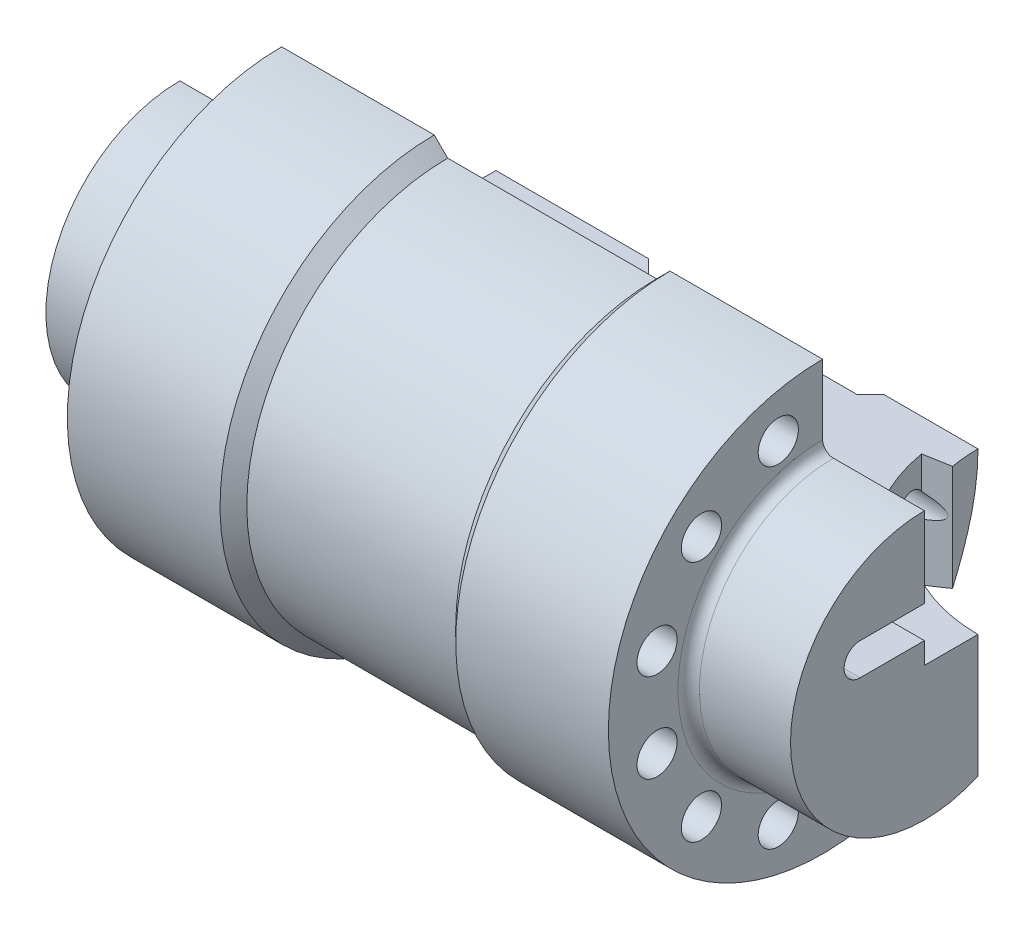
from build123d import *

# Parameters (mm, degrees)
REVOLVE1_ANGLE     = 270
CUT_EXTRUDE1_DEPTH = 151.069983674
SKETCH3_R          = 3.75
CUT_EXTRUDE2_DEPTH = 133.664991614
SKETCH5_R          = 30
CUT_EXTRUDE3_DEPTH = 151.069983674
CUT_EXTRUDE4_DEPTH = 151.06998382
CUT_EXTRUDE5_DEPTH = 10


with BuildPart() as part:
    # Sketch1 → Revolve1 (revolve)
    with BuildSketch(Plane.XY):
        with BuildLine():
            Line((47.5, 40), (50, 37.5))
            Line((50, 37.5), (89, 37.5))
            Line((89, 37.5), (91.5, 40))
            Line((91.5, 40), (120, 40))
            Line((120, 40), (120, 27))
            ThreePointArc((120, 27), (120.585786438, 25.585786438), (122, 25))
            Line((122, 25), (139, 25))
            Line((139, 25), (139, 0))
            Line((139, 0), (0, 0))
            Line((0, 0), (0, 25))
            Line((0, 25), (17, 25))
            ThreePointArc((17, 25), (18.414213562, 25.585786438), (19, 27))
            Line((19, 27), (19, 40))
            Line((19, 40), (47.5, 40))
        make_face()
    revolve(axis=Axis((0, 0, 0), (1, 0, 0)), revolution_arc=REVOLVE1_ANGLE)

    # Sketch2 → Cut-Extrude1 (cut, through all)
    with BuildSketch(Plane.ZY):
        with BuildLine():
            Line((0, 10), (12, 10))
            ThreePointArc((12, 10), (15, 7), (12, 4))
            Line((12, 4), (0, 4))
            ThreePointArc((0, 4), (-3, 7), (0, 10))
        make_face()
    extrude(amount=-CUT_EXTRUDE1_DEPTH, mode=Mode.SUBTRACT)

    # Sketch3 → Cut-Extrude2 (cut, through all)
    with BuildSketch(Plane(origin=(120, 0, 0), x_dir=(0, 0, -1), z_dir=(1, 0, 0))):
        with Locations((-8.282209443, 30.909626441)):
            Circle(SKETCH3_R)
        with Locations((30.909626441, -8.282209443)):
            Circle(SKETCH3_R)
        with Locations((22.627416998, -22.627416998)):
            Circle(SKETCH3_R)
        with Locations((8.282209443, -30.909626441)):
            Circle(SKETCH3_R)
        with Locations((-8.282209443, -30.909626441)):
            Circle(SKETCH3_R)
        with Locations((-22.627416998, -22.627416998)):
            Circle(SKETCH3_R)
        with Locations((-30.909626441, -8.282209443)):
            Circle(SKETCH3_R)
        with Locations((-30.909626441, 8.282209443)):
            Circle(SKETCH3_R)
        with Locations((-22.627416998, 22.627416998)):
            Circle(SKETCH3_R)
    extrude(amount=-CUT_EXTRUDE2_DEPTH, mode=Mode.SUBTRACT)

    # Sketch5 → Cut-Extrude3 (cut, through all)
    with BuildSketch(Plane(origin=(0, 0, 0), x_dir=(1, 0, 0), z_dir=(0, 1, 0))):
        with Locations((139, 40)):
            Circle(SKETCH5_R)
    extrude(amount=-CUT_EXTRUDE3_DEPTH, mode=Mode.SUBTRACT)

    # Sketch6 → Cut-Extrude4 (cut, through all)
    with BuildSketch(Plane(origin=(0, 0, 0), x_dir=(1, 0, 0), z_dir=(0, 1, 0))):
        with BuildLine():
            Line((104.531728645, 33.922313782), (109.45576741, 34.79055467))
            ThreePointArc((109.45576741, 34.79055467), (115.199399791, 21.73715713), (126.321452148, 12.810766389))
            Line((126.321452148, 12.810766389), (124.208360839, 8.279227454))
            ThreePointArc((124.208360839, 8.279227454), (111.23263309, 18.693349985), (104.531728645, 33.922313782))
        make_face()
    extrude(amount=-CUT_EXTRUDE4_DEPTH, mode=Mode.SUBTRACT)

    # Sketch8 → Cut-Extrude5 (cut)
    with BuildSketch(Plane.ZY):
        with BuildLine():
            Line((-19.364916731, -4), (-0.400463796, -4))
            Line((-0.400463796, -4), (3, -4))
            ThreePointArc((3, -4), (3.707106781, -3.707106781), (4, -3))
            Line((4, -3), (4, -0.903690713))
            ThreePointArc((4, -0.903690713), (4.292893219, -0.196583931), (5, 0.096309287))
            Line((5, 0.096309287), (19.979573146, 0.096309287))
            ThreePointArc((19.979573146, 0.096309287), (20.702478581, -0.21274373), (20.978551803, -0.948875248))
            ThreePointArc((20.978551803, -0.948875248), (2.174637981, -20.887100078), (-20.333162568, -5.25))
            ThreePointArc((-20.333162568, -5.25), (-20.155486146, -4.387627564), (-19.364916731, -4))
        make_face()
    extrude(amount=-CUT_EXTRUDE5_DEPTH, mode=Mode.SUBTRACT)


solid = part.part
